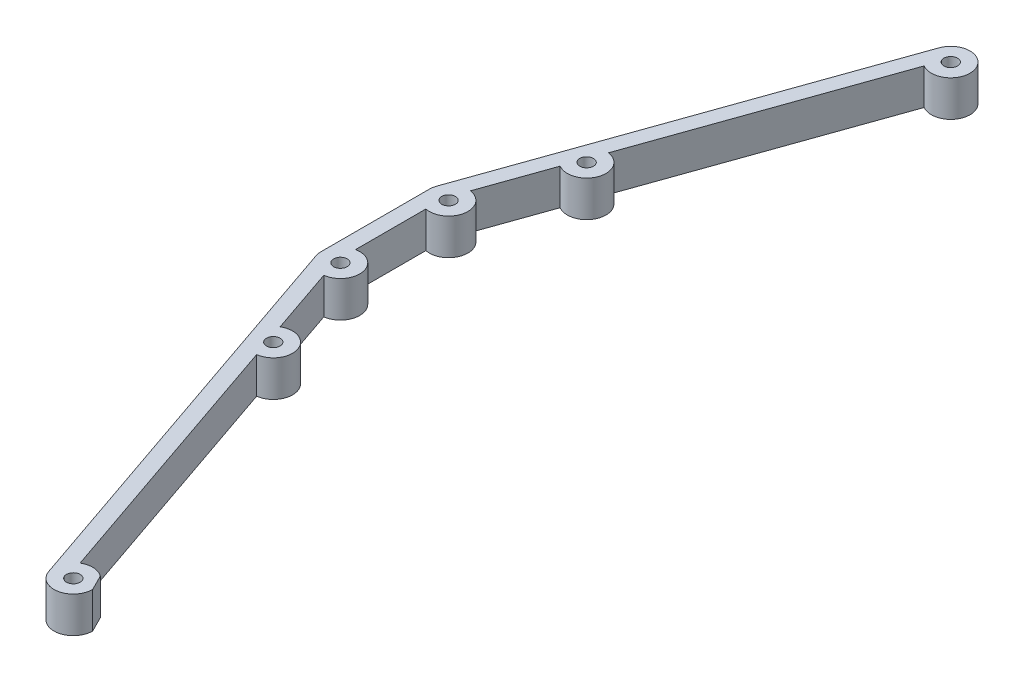
from build123d import *

# Parameters (mm, degrees)
SKETCH1_R           = 2.65
SKETCH1_R_2         = 7.5
BOSS_EXTRUDE2_DEPTH = 14


with BuildPart() as part:
    # Sketch1 → Boss-Extrude2 (new body)
    # profile 1 of 17: a face of its own
    with BuildSketch(Plane(origin=(0, 0, 0), x_dir=(1, 0, 0), z_dir=(0, 1, 0))):
        with BuildLine():
            ThreePointArc((54.623301063, -191.851720312), (51.393371136, -195.715064378), (51.3348715, -200.750384875))
            ThreePointArc((51.3348715, -200.750384875), (59.663021267, -205.712476174), (65.928383174, -198.314796214))
            ThreePointArc((65.928383174, -198.314796214), (65.928340244, -198.289420057), (65.928211455, -198.26404419))
            Line((65.928211455, -198.26404419), (62.928383174, -192.314796214))
            ThreePointArc((62.928383174, -192.314796214), (58.845920647, -190.826427737), (54.623301063, -191.851720312))
        make_face()
        with Locations(Location((58.428383174, -198.314796214, 0), (0, 0, 270))):
            Circle(SKETCH1_R, mode=Mode.SUBTRACT)
    # profile 2 of 17: a face of its own
    with BuildSketch(Plane(origin=(0, 0, 0), x_dir=(1, 0, 0), z_dir=(0, 1, 0))):
        with BuildLine():
            ThreePointArc((18.785357114, -87.475772959), (13.863470513, -86.411391053), (10.724167872, -82.474049884))
            Line((10.724167872, -82.474049884), (51.3348715, -200.750384875))
            ThreePointArc((51.3348715, -200.750384875), (51.393371136, -195.715064378), (54.623301063, -191.851720312))
            Line((54.623301063, -191.851720312), (18.785357114, -87.475772959))
        make_face()
    # profile 3 of 17: a face of its own
    with BuildSketch(Plane(origin=(0, 0, 0), x_dir=(1, 0, 0), z_dir=(0, 1, 0))):
        with BuildLine():
            ThreePointArc((14.012597561, -73.575385689), (10.782667702, -77.438729573), (10.724167872, -82.474049884))
            ThreePointArc((10.724167872, -82.474049884), (13.863470513, -86.411391053), (18.785357114, -87.475772959))
            Line((18.785357114, -87.475772959), (17.1084173, -82.591782349))
            ThreePointArc((17.1084173, -82.591782349), (15.311305548, -80.899036252), (15.689537375, -78.459376299))
            Line((15.689537375, -78.459376299), (14.012597561, -73.575385689))
        make_face()
    # profile 4 of 17: a face of its own
    with BuildSketch(Plane(origin=(0, 0, 0), x_dir=(1, 0, 0), z_dir=(0, 1, 0))):
        with BuildLine():
            ThreePointArc((25.317679673, -80.038461592), (21.540036733, -73.527389644), (14.012597561, -73.575385689))
            Line((14.012597561, -73.575385689), (15.689537375, -78.459376299))
            ThreePointArc((15.689537375, -78.459376299), (18.649221287, -77.522306083), (20.467679673, -80.038461592))
            ThreePointArc((20.467679673, -80.038461592), (19.421262336, -82.148206279), (17.1084173, -82.591782349))
            Line((17.1084173, -82.591782349), (18.785357114, -87.475772959))
            ThreePointArc((18.785357114, -87.475772959), (23.452729842, -84.987826157), (25.317679673, -80.038461592))
        make_face()
    # profile 5 of 17: a face of its own
    with BuildSketch(Plane(origin=(0, 0, 0), x_dir=(1, 0, 0), z_dir=(0, 1, 0))):
        with BuildLine():
            ThreePointArc((14.012597561, -73.575385689), (10.782667702, -77.438729573), (10.724167872, -82.474049884))
            ThreePointArc((10.724167872, -82.474049884), (13.863470513, -86.411391053), (18.785357114, -87.475772959))
            Line((18.785357114, -87.475772959), (17.1084173, -82.591782349))
            ThreePointArc((17.1084173, -82.591782349), (15.311305548, -80.899036252), (15.689537375, -78.459376299))
            Line((15.689537375, -78.459376299), (14.012597561, -73.575385689))
        make_face()
    # profile 6 of 17: a face of its own
    with BuildSketch(Plane(origin=(0, 0, 0), x_dir=(1, 0, 0), z_dir=(0, 1, 0))):
        with BuildLine():
            ThreePointArc((25.317679673, -80.038461592), (21.540036733, -73.527389644), (14.012597561, -73.575385689))
            Line((14.012597561, -73.575385689), (15.689537375, -78.459376299))
            ThreePointArc((15.689537375, -78.459376299), (18.649221287, -77.522306083), (20.467679673, -80.038461592))
            ThreePointArc((20.467679673, -80.038461592), (19.421262336, -82.148206279), (17.1084173, -82.591782349))
            Line((17.1084173, -82.591782349), (18.785357114, -87.475772959))
            ThreePointArc((18.785357114, -87.475772959), (23.452729842, -84.987826157), (25.317679673, -80.038461592))
        make_face()
    # profile 7 of 17: a face of its own
    with BuildSketch(Plane(origin=(0, 0, 0), x_dir=(1, 0, 0), z_dir=(0, 1, 0))):
        with BuildLine():
            ThreePointArc((5.146060616, -47.752107581), (0.22417418, -46.687725778), (-2.9151285, -42.750384875))
            Line((-2.9151285, -42.750384875), (10.724167872, -82.474049884))
            ThreePointArc((10.724167872, -82.474049884), (10.782667702, -77.438729573), (14.012597561, -73.575385689))
            Line((14.012597561, -73.575385689), (5.146060616, -47.752107581))
        make_face()
    # profile 8 of 17: a face of its own
    with BuildSketch(Plane(origin=(0, 0, 0), x_dir=(1, 0, 0), z_dir=(0, 1, 0))):
        with Locations((4.178383174, -40.314796214)):
            Circle(SKETCH1_R_2)
        with Locations(Location((4.178383174, -40.314796214, 0), (0, 0, 270))):
            Circle(SKETCH1_R, mode=Mode.SUBTRACT)
    # profile 9 of 17: a face of its own
    with BuildSketch(Plane(origin=(0, 0, 0), x_dir=(1, 0, 0), z_dir=(0, 1, 0))):
        with BuildLine():
            ThreePointArc((2.678383174, -5.663265443), (-1.631091845, -3.058212705), (-3.321616826, 1.685203786))
            Line((-3.321616826, 1.685203786), (-3.321616826, -40.314796214))
            ThreePointArc((-3.321616826, -40.314796214), (-1.631091845, -35.571379724), (2.678383174, -32.966326986))
            Line((2.678383174, -32.966326986), (2.678383174, -5.663265443))
        make_face()
    # profile 10 of 17: a face of its own
    with BuildSketch(Plane(origin=(0, 0, 0), x_dir=(1, 0, 0), z_dir=(0, 1, 0))):
        with Locations((4.178383174, 1.685203786)):
            Circle(SKETCH1_R_2)
        with Locations(Location((4.178383174, 1.685203786, 0), (0, 0, 270))):
            Circle(SKETCH1_R, mode=Mode.SUBTRACT)
    # profile 11 of 17: a face of its own
    with BuildSketch(Plane(origin=(0, 0, 0), x_dir=(1, 0, 0), z_dir=(0, 1, 0))):
        with BuildLine():
            ThreePointArc((14.332756859, 34.849450798), (11.140217836, 38.743750227), (11.130258872, 43.77940056))
            Line((11.130258872, 43.77940056), (-2.891321014, 4.189057352))
            ThreePointArc((-2.891321014, 4.189057352), (0.285789897, 8.095953943), (5.217707788, 9.112841657))
            Line((5.217707788, 9.112841657), (14.332756859, 34.849450798))
        make_face()
    # profile 12 of 17: a face of its own
    with BuildSketch(Plane(origin=(0, 0, 0), x_dir=(1, 0, 0), z_dir=(0, 1, 0))):
        with BuildLine():
            ThreePointArc((19.239287763, 48.703185114), (14.307369759, 47.686297331), (11.130258872, 43.77940056))
            ThreePointArc((11.130258872, 43.77940056), (11.140217836, 38.743750227), (14.332756859, 34.849450798))
            Line((14.332756859, 34.849450798), (16.056698099, 39.717049592))
            ThreePointArc((16.056698099, 39.717049592), (15.702001002, 42.160242169), (17.515346523, 43.835586319))
            Line((17.515346523, 43.835586319), (19.239287763, 48.703185114))
        make_face()
    # profile 13 of 17: a face of its own
    with BuildSketch(Plane(origin=(0, 0, 0), x_dir=(1, 0, 0), z_dir=(0, 1, 0))):
        with BuildLine():
            ThreePointArc((25.699963149, 41.275547242), (23.858802898, 46.197694406), (19.239287763, 48.703185114))
            Line((19.239287763, 48.703185114), (17.515346523, 43.835586319))
            ThreePointArc((17.515346523, 43.835586319), (19.813695769, 43.377538448), (20.849963149, 41.275547242))
            ThreePointArc((20.849963149, 41.275547242), (19.019367694, 38.755413081), (16.056698099, 39.717049592))
            Line((16.056698099, 39.717049592), (14.332756859, 34.849450798))
            ThreePointArc((14.332756859, 34.849450798), (21.890894795, 34.746609841), (25.699963149, 41.275547242))
        make_face()
    # profile 14 of 17: a face of its own
    with BuildSketch(Plane(origin=(0, 0, 0), x_dir=(1, 0, 0), z_dir=(0, 1, 0))):
        with BuildLine():
            ThreePointArc((19.239287763, 48.703185114), (14.307369759, 47.686297331), (11.130258872, 43.77940056))
            ThreePointArc((11.130258872, 43.77940056), (11.140217836, 38.743750227), (14.332756859, 34.849450798))
            Line((14.332756859, 34.849450798), (16.056698099, 39.717049592))
            ThreePointArc((16.056698099, 39.717049592), (15.702001002, 42.160242169), (17.515346523, 43.835586319))
            Line((17.515346523, 43.835586319), (19.239287763, 48.703185114))
        make_face()
    # profile 15 of 17: a face of its own
    with BuildSketch(Plane(origin=(0, 0, 0), x_dir=(1, 0, 0), z_dir=(0, 1, 0))):
        with BuildLine():
            ThreePointArc((25.699963149, 41.275547242), (23.858802898, 46.197694406), (19.239287763, 48.703185114))
            Line((19.239287763, 48.703185114), (17.515346523, 43.835586319))
            ThreePointArc((17.515346523, 43.835586319), (19.813695769, 43.377538448), (20.849963149, 41.275547242))
            ThreePointArc((20.849963149, 41.275547242), (19.019367694, 38.755413081), (16.056698099, 39.717049592))
            Line((16.056698099, 39.717049592), (14.332756859, 34.849450798))
            ThreePointArc((14.332756859, 34.849450798), (21.890894795, 34.746609841), (25.699963149, 41.275547242))
        make_face()
    # profile 16 of 17: a face of its own
    with BuildSketch(Plane(origin=(0, 0, 0), x_dir=(1, 0, 0), z_dir=(0, 1, 0))):
        with BuildLine():
            ThreePointArc((51.311176885, 139.259107341), (48.118637818, 143.153406895), (48.108678986, 148.189057352))
            Line((48.108678986, 148.189057352), (11.130258872, 43.77940056))
            ThreePointArc((11.130258872, 43.77940056), (14.307369759, 47.686297331), (19.239287763, 48.703185114))
            Line((19.239287763, 48.703185114), (51.311176885, 139.259107341))
        make_face()
    # profile 17 of 17: a face of its own
    with BuildSketch(Plane(origin=(0, 0, 0), x_dir=(1, 0, 0), z_dir=(0, 1, 0))):
        with Locations((55.178383174, 145.685203786)):
            Circle(SKETCH1_R_2)
        with Locations(Location((55.178383174, 145.685203786, 0), (0, 0, 270))):
            Circle(SKETCH1_R, mode=Mode.SUBTRACT)
    extrude(amount=BOSS_EXTRUDE2_DEPTH)


solid = part.part
